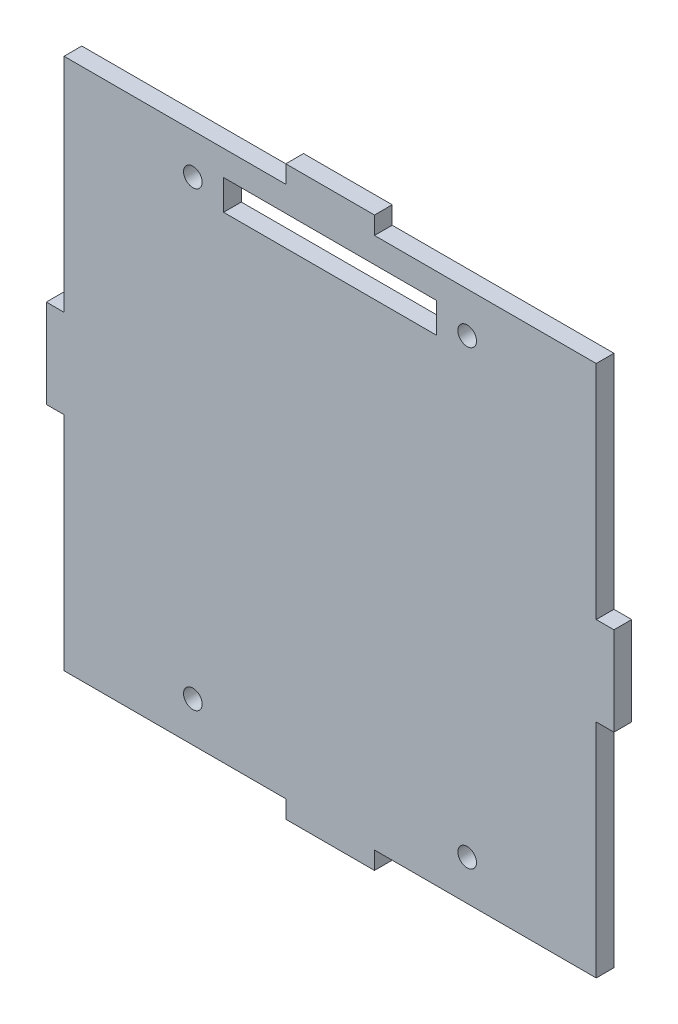
from build123d import *

# Parameters (mm, degrees)
EXTRUDE_1_DEPTH     = 2
SKETCH_2_R          = 1.05
SKETCH_2_R_2        = 1.05760355
CUT_EXTRUDE_1_DEPTH = 6
CUT_EXTRUDE_2_DEPTH = 4


with BuildPart() as part:
    # 草图1 → 凸台-拉伸1 (new body)
    with BuildSketch(Plane.XY):
        Polygon((-4.597711938, -13.43249055), (-4.597711938, -38.43249055), (-29.597711938, -38.43249055), (-29.597711938, -40.43249055), (-34.597711938, -40.43249055), (-39.597711938, -40.43249055), (-39.597711938, -38.43249055), (-64.597711938, -38.43249055), (-64.597711938, -13.43249055), (-66.597711938, -13.43249055), (-66.597711938, -8.43249055), (-66.597711938, -3.43249055), (-64.597711938, -3.43249055), (-64.597711938, 21.56750945), (-39.597711938, 21.56750945), (-39.597711938, 23.56750945), (-29.597711938, 23.56750945), (-29.597711938, 21.56750945), (-4.597711938, 21.56750945), (-4.597711938, -3.43249055), (-2.597711938, -3.43249055), (-2.597711938, -13.43249055), align=None)
    extrude(amount=EXTRUDE_1_DEPTH)

    # 草图2 → 切除-拉伸1 (cut)
    with BuildSketch(Plane.XY):
        with Locations(Location((-50.075826656, 17.046317073, 0), (0, 0, 180))):
            Circle(SKETCH_2_R)
        with Locations(Location((-19.146292681, 17.004293118, 0), (0, 0, 180))):
            Circle(SKETCH_2_R_2)
        with Locations(Location((-19.146292681, -33.910264006, 0), (0, 0, 180))):
            Circle(SKETCH_2_R)
        with Locations(Location((-50.075826656, -33.910264006, 0), (0, 0, 180))):
            Circle(SKETCH_2_R)
    extrude(amount=CUT_EXTRUDE_1_DEPTH, mode=Mode.SUBTRACT)

    # 草图4 → 切除-拉伸2 (cut)
    with BuildSketch(Plane.XY):
        Polygon((-32.878676175, 18.720597517), (-22.611059668, 18.720597517), (-22.611059668, 15.325305096), (-32.878676175, 15.325305096), (-46.611059668, 15.325305096), (-46.611059668, 18.720597517), align=None)
    extrude(amount=CUT_EXTRUDE_2_DEPTH, mode=Mode.SUBTRACT)


solid = part.part
